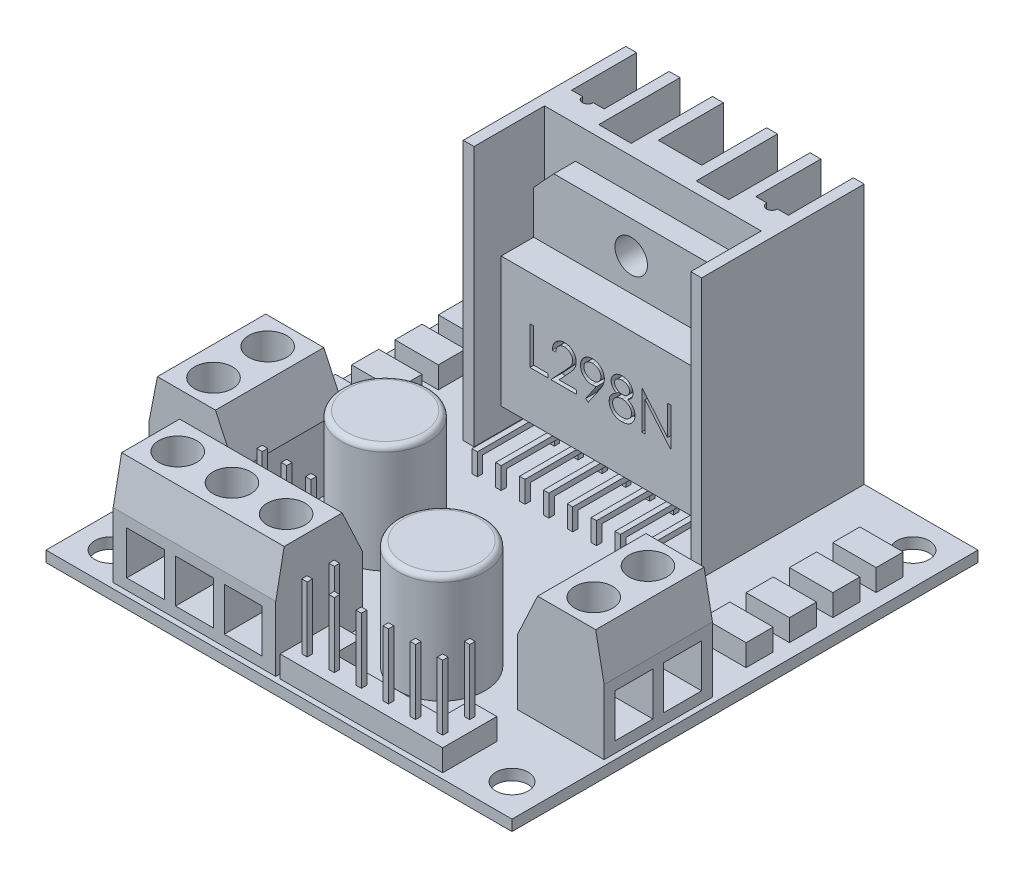
from build123d import *
from OCP.BRepFilletAPI import BRepFilletAPI_MakeChamfer

# Parameters (mm, degrees)
BASE_SKETCH_W             = 43
BASE_SKETCH_H             = 43
BASE_SKETCH_R             = 1.5
BASE_DEPTH                = 1
RADIATOR_DEPTH            = 24
TERMINAL_1_SKETCH_W       = 8
TERMINAL_1_SKETCH_H       = 10
TERMINAL_1_DEPTH          = 10
TERMINAL_2_SKETCH_W       = 15
TERMINAL_2_SKETCH_H       = 8
TERMINAL_2_DEPTH          = 10
CHAMFER_25_SIZE           = 4
CHAMFER_25_SIZE2          = 1.865230633
CHAMFER_10_SIZE           = 4
CHAMFER_10_SIZE2          = 0.777521237
DIODE_SKETCH_W            = 4
DIODE_SKETCH_H            = 2.5
DIODE_DEPTH               = 2
CAPACITOR_SKETCH_R        = 4
CAPACITOR_DEPTH           = 10
FILLET_2_R                = 0.5
RAIL_6_DEPTH              = 2
RAIL_3_SKETCH_W           = 6.6
RAIL_3_SKETCH_H           = 2.2
RAIL_3_DEPTH              = 2
JACK_6_SKETCH_W           = 0.25
JACK_6_SKETCH_H           = 0.25
JACK_6_SKETCH_H_2         = 0.5
JACK_6_SKETCH_W_2         = 0.5
JACK_6_DEPTH              = 6
JACK_3_SKETCH_W           = 0.5
JACK_3_SKETCH_H           = 0.5
JACK_3_DEPTH              = 6
L298_IC_DEPTH             = 5
L298_CUT_SKETCH_W         = 18
L298_CUT_SKETCH_H         = 6
L298_CUT_DEPTH            = 3
L298_LEG_1_SKETCH_W       = 0.5
L298_LEG_1_SKETCH_H       = 0.5
L298_LEG_1_DEPTH          = 1.5
L298_LEG_2_SKETCH_W       = 0.5
L298_LEG_2_SKETCH_H       = 0.5
L298_LEG_2_DEPTH          = 6
L298_LEG_3_SKETCH_W       = 0.5
L298_LEG_3_SKETCH_H       = 0.5
L298_LEG_3_DEPTH          = 2.5
BOSS_EXTRUDE1_REACH       = 67.376
SKETCH1_W                 = 0.5
SKETCH1_H                 = 0.5
L298_NAME_DEPTH           = 1
ROLE_SKETCH_R             = 1.5
ROLE_DEPTH                = 60.415906961
ROLE_TERMINAL_1A_SKETCH_W = 3.5
ROLE_TERMINAL_1A_SKETCH_H = 4
ROLE_TERMINAL_1A_DEPTH    = 4
ROLE_TERMINAL_1B_SKETCH_W = 3.5
ROLE_TERMINAL_1B_SKETCH_H = 4
ROLE_TERMINAL_1B_DEPTH    = 3.5
ROLE_TERMINAL_2_SKETCH_W  = 3.5
ROLE_TERMINAL_2_SKETCH_H  = 4
ROLE_TERMINAL_2_DEPTH     = 3.5
SKETCH4_R                 = 1.75
ROLE_TERMINAL_3_DEPTH     = 3.5


with BuildPart() as part:
    # base_sketch → base (new body)
    with BuildSketch(Plane(origin=(0, 0, 0), x_dir=(1, 0, 0), z_dir=(0, 1, 0))):
        with Locations((-21.5, -21.5)):
            Rectangle(BASE_SKETCH_W, BASE_SKETCH_H)
        with Locations(Location((-40, -3, 0), (0, 0, 270))):
            Circle(BASE_SKETCH_R, mode=Mode.SUBTRACT)
        with Locations(Location((-3, -3, 0), (0, 0, 270))):
            Circle(BASE_SKETCH_R, mode=Mode.SUBTRACT)
        with Locations(Location((-40, -40, 0), (0, 0, 270))):
            Circle(BASE_SKETCH_R, mode=Mode.SUBTRACT)
        with Locations(Location((-3, -40, 0), (0, 0, 270))):
            Circle(BASE_SKETCH_R, mode=Mode.SUBTRACT)
    extrude(amount=BASE_DEPTH)

    # radiator_sketch → radiator (add)
    with BuildSketch(Plane(origin=(0, 1, 0), x_dir=(-1, 0, 0), z_dir=(0, 1, 0))):
        with BuildLine():
            Line((10.5, 0), (11.5, 0))
            Line((11.5, 0), (11.5, 6))
            Line((11.5, 6), (12.5, 6))
            ThreePointArc((12.5, 6), (13, 6.5), (13.5, 6))
            Line((13.5, 6), (14.5, 6))
            Line((14.5, 6), (14.5, 0))
            Line((14.5, 0), (15.5, 0))
            Line((15.5, 0), (15.5, 7.5))
            Line((15.5, 7.5), (18.5, 7.5))
            Line((18.5, 7.5), (18.5, 0))
            Line((18.5, 0), (19.5, 0))
            Line((19.5, 0), (19.5, 6))
            Line((19.5, 6), (23.5, 6))
            Line((23.5, 6), (23.5, 0))
            Line((23.5, 0), (24.5, 0))
            Line((24.5, 0), (24.5, 7.5))
            Line((24.5, 7.5), (27.5, 7.5))
            Line((27.5, 7.5), (27.5, 0))
            Line((27.5, 0), (28.5, 0))
            Line((28.5, 0), (28.5, 6))
            Line((28.5, 6), (29.5, 6))
            ThreePointArc((29.5, 6), (30, 6.5), (30.5, 6))
            Line((30.5, 6), (31.5, 6))
            Line((31.5, 6), (31.5, 0))
            Line((31.5, 0), (32.5, 0))
            Line((32.5, 0), (32.5, 15))
            Line((32.5, 15), (31.5, 15))
            Line((31.5, 15), (31.5, 8.5))
            Line((31.5, 8.5), (11.5, 8.5))
            Line((11.5, 8.5), (11.5, 15))
            Line((11.5, 15), (10.5, 15))
            Line((10.5, 15), (10.5, 0))
        make_face()
    extrude(amount=RADIATOR_DEPTH)

    # terminal_1_sketch → terminal_1 (add)
    with BuildSketch(Plane(origin=(0, 1, 0), x_dir=(-1, 0, 0), z_dir=(0, 1, 0))):
        with Locations((4.5, 29)):
            Rectangle(TERMINAL_1_SKETCH_W, TERMINAL_1_SKETCH_H)
        with Locations((38.5, 29)):
            Rectangle(TERMINAL_1_SKETCH_W, TERMINAL_1_SKETCH_H)
    extrude(amount=TERMINAL_1_DEPTH)

    # terminal_2_sketch → terminal_2 (add)
    with BuildSketch(Plane(origin=(0, 1, 0), x_dir=(-1, 0, 0), z_dir=(0, 1, 0))):
        with Locations((29.8, 38.5)):
            Rectangle(TERMINAL_2_SKETCH_W, TERMINAL_2_SKETCH_H)
    extrude(amount=TERMINAL_2_DEPTH)

    # chamfer_25: one chamfer whose edges measure the first distance from different faces: ONE call of the kernel's chamfer builder (chamfer() names one face for all edges)
    chamfer_25_edges_1 = [part.edges().sort_by_distance(p)[0] for p in [
        (-34.5, 11, 29),
    ]]
    chamfer_25_side_1 = [part.faces().sort_by_distance(p)[0] for p in [
        (-34.5, 6, 29),
    ]]
    chamfer_25_edges_2 = [part.edges().sort_by_distance(p)[0] for p in [
        (-8.5, 11, 29),
    ]]
    chamfer_25_side_2 = [part.faces().sort_by_distance(p)[0] for p in [
        (-8.5, 6, 29),
    ]]
    chamfer_25_edges_3 = [part.edges().sort_by_distance(p)[0] for p in [
        (-29.8, 11, 34.5),
    ]]
    chamfer_25_side_3 = [part.faces().sort_by_distance(p)[0] for p in [
        (-29.8, 6, 34.5),
    ]]
    chamfer_25 = BRepFilletAPI_MakeChamfer(part.part.solid().wrapped)
    for e in chamfer_25_edges_1:
        chamfer_25.Add(CHAMFER_25_SIZE, CHAMFER_25_SIZE2, e.wrapped, chamfer_25_side_1[0].wrapped)  # the first distance lies on this face
    for e in chamfer_25_edges_2:
        chamfer_25.Add(CHAMFER_25_SIZE, CHAMFER_25_SIZE2, e.wrapped, chamfer_25_side_2[0].wrapped)  # the first distance lies on this face
    for e in chamfer_25_edges_3:
        chamfer_25.Add(CHAMFER_25_SIZE, CHAMFER_25_SIZE2, e.wrapped, chamfer_25_side_3[0].wrapped)  # the first distance lies on this face
    add(Compound.cast(chamfer_25.Shape()), mode=Mode.REPLACE)

    # chamfer_10: one chamfer whose edges measure the first distance from different faces: ONE call of the kernel's chamfer builder (chamfer() names one face for all edges)
    chamfer_10_edges_1 = [part.edges().sort_by_distance(p)[0] for p in [
        (-42.5, 11, 29),
    ]]
    chamfer_10_side_1 = [part.faces().sort_by_distance(p)[0] for p in [
        (-42.5, 6, 29),
    ]]
    chamfer_10_edges_2 = [part.edges().sort_by_distance(p)[0] for p in [
        (-0.5, 11, 29),
    ]]
    chamfer_10_side_2 = [part.faces().sort_by_distance(p)[0] for p in [
        (-0.5, 6, 29),
    ]]
    chamfer_10_edges_3 = [part.edges().sort_by_distance(p)[0] for p in [
        (-29.8, 11, 42.5),
    ]]
    chamfer_10_side_3 = [part.faces().sort_by_distance(p)[0] for p in [
        (-29.8, 6, 42.5),
    ]]
    chamfer_10 = BRepFilletAPI_MakeChamfer(part.part.solid().wrapped)
    for e in chamfer_10_edges_1:
        chamfer_10.Add(CHAMFER_10_SIZE, CHAMFER_10_SIZE2, e.wrapped, chamfer_10_side_1[0].wrapped)  # the first distance lies on this face
    for e in chamfer_10_edges_2:
        chamfer_10.Add(CHAMFER_10_SIZE, CHAMFER_10_SIZE2, e.wrapped, chamfer_10_side_2[0].wrapped)  # the first distance lies on this face
    for e in chamfer_10_edges_3:
        chamfer_10.Add(CHAMFER_10_SIZE, CHAMFER_10_SIZE2, e.wrapped, chamfer_10_side_3[0].wrapped)  # the first distance lies on this face
    add(Compound.cast(chamfer_10.Shape()), mode=Mode.REPLACE)

    # diode_sketch → diode (add)
    with BuildSketch(Plane(origin=(0, 1, 0), x_dir=(-1, 0, 0), z_dir=(0, 1, 0))):
        with Locations((3.3, 10.85)):
            Rectangle(DIODE_SKETCH_W, DIODE_SKETCH_H)
        with Locations((3.3, 6.85)):
            Rectangle(DIODE_SKETCH_W, DIODE_SKETCH_H)
        with Locations((3.3, 14.85)):
            Rectangle(DIODE_SKETCH_W, DIODE_SKETCH_H)
        with Locations((3.3, 18.85)):
            Rectangle(DIODE_SKETCH_W, DIODE_SKETCH_H)
        with Locations((39.7, 18.85)):
            Rectangle(DIODE_SKETCH_W, DIODE_SKETCH_H)
        with Locations((39.7, 14.85)):
            Rectangle(DIODE_SKETCH_W, DIODE_SKETCH_H)
        with Locations((39.7, 10.85)):
            Rectangle(DIODE_SKETCH_W, DIODE_SKETCH_H)
        with Locations((39.7, 6.85)):
            Rectangle(DIODE_SKETCH_W, DIODE_SKETCH_H)
    extrude(amount=DIODE_DEPTH)

    # capacitor_sketch → capacitor (add)
    with BuildSketch(Plane(origin=(0, 1, 0), x_dir=(-1, 0, 0), z_dir=(0, 1, 0))):
        with Locations(Location((28.5, 26.2, 0), (0, 0, 90))):
            Circle(CAPACITOR_SKETCH_R)
        with Locations(Location((15.5, 34, 0), (0, 0, 90))):
            Circle(CAPACITOR_SKETCH_R)
    extrude(amount=CAPACITOR_DEPTH)

    # fillet 2
    fillet_2_edges = [part.edges().sort_by_distance(p)[0] for p in [
        (-28.5, 11, 22.2),
        (-15.5, 11, 30),
    ]]
    fillet(fillet_2_edges, radius=FILLET_2_R)

    # rail_6_sketch → rail_6 (add)
    with BuildSketch(Plane(origin=(0, 1, 0), x_dir=(-1, 0, 0), z_dir=(0, 1, 0))):
        Polygon((21.9, 42.5), (6.9, 42.5), (6.9, 37.5), (9.4, 37.5), (9.4, 40), (19.4, 40), (19.4, 37.5), (21.9, 37.5), align=None)
    extrude(amount=RAIL_6_DEPTH)

    # rail_3_sketch → rail_3 (add)
    with BuildSketch(Plane(origin=(0, 1, 0), x_dir=(-1, 0, 0), z_dir=(0, 1, 0))):
        with Locations((30.9, 32.9)):
            Rectangle(RAIL_3_SKETCH_W, RAIL_3_SKETCH_H)
    extrude(amount=RAIL_3_DEPTH)

    # jack_6_sketch → jack_6 (add)
    with BuildSketch(Plane(origin=(0, 3, 0), x_dir=(-1, 0, 0), z_dir=(0, 1, 0))):
        with Locations((20.525, 41.375)):
            Rectangle(JACK_6_SKETCH_W, JACK_6_SKETCH_H)
        with Locations((20.525, 41.125)):
            Rectangle(JACK_6_SKETCH_W, JACK_6_SKETCH_H)
        with Locations((20.775, 41.375)):
            Rectangle(JACK_6_SKETCH_W, JACK_6_SKETCH_H)
        with Locations((20.775, 41.125)):
            Rectangle(JACK_6_SKETCH_W, JACK_6_SKETCH_H)
        with Locations((20.525, 38.75)):
            Rectangle(JACK_6_SKETCH_W, JACK_6_SKETCH_H_2)
        with Locations((20.775, 38.75)):
            Rectangle(JACK_6_SKETCH_W, JACK_6_SKETCH_H_2)
        with Locations((18.15, 41.125)):
            Rectangle(JACK_6_SKETCH_W_2, JACK_6_SKETCH_H)
        with Locations((18.15, 41.375)):
            Rectangle(JACK_6_SKETCH_W_2, JACK_6_SKETCH_H)
        with Locations((15.65, 41.125)):
            Rectangle(JACK_6_SKETCH_W_2, JACK_6_SKETCH_H)
        with Locations((15.65, 41.375)):
            Rectangle(JACK_6_SKETCH_W_2, JACK_6_SKETCH_H)
        with Locations((13.15, 41.375)):
            Rectangle(JACK_6_SKETCH_W_2, JACK_6_SKETCH_H)
        with Locations((13.15, 41.125)):
            Rectangle(JACK_6_SKETCH_W_2, JACK_6_SKETCH_H)
        with Locations((10.65, 41.375)):
            Rectangle(JACK_6_SKETCH_W_2, JACK_6_SKETCH_H)
        with Locations((10.65, 41.125)):
            Rectangle(JACK_6_SKETCH_W_2, JACK_6_SKETCH_H)
        with Locations((8.025, 41.375)):
            Rectangle(JACK_6_SKETCH_W, JACK_6_SKETCH_H)
        with Locations((8.025, 41.125)):
            Rectangle(JACK_6_SKETCH_W, JACK_6_SKETCH_H)
        with Locations((8.275, 41.125)):
            Rectangle(JACK_6_SKETCH_W, JACK_6_SKETCH_H)
        with Locations((8.275, 41.375)):
            Rectangle(JACK_6_SKETCH_W, JACK_6_SKETCH_H)
        with Locations((8.025, 38.75)):
            Rectangle(JACK_6_SKETCH_W, JACK_6_SKETCH_H_2)
        with Locations((8.275, 38.75)):
            Rectangle(JACK_6_SKETCH_W, JACK_6_SKETCH_H_2)
    extrude(amount=JACK_6_DEPTH)

    # jack_3_sketch → jack_3 (add)
    with BuildSketch(Plane(origin=(0, 3, 0), x_dir=(1, 0, 0), z_dir=(0, 1, 0))):
        with Locations((-30.9, -32.9)):
            Rectangle(JACK_3_SKETCH_W, JACK_3_SKETCH_H)
        with Locations((-33.15, -32.9)):
            Rectangle(JACK_3_SKETCH_W, JACK_3_SKETCH_H)
        with Locations((-28.65, -32.9)):
            Rectangle(JACK_3_SKETCH_W, JACK_3_SKETCH_H)
    extrude(amount=JACK_3_DEPTH)

    # L298_sketch → L298_IC (add)
    with BuildSketch(Plane.XY.offset(8.5)):
        Polygon((-30.5, 19.987466442), (-30.5, 4), (-12.5, 4), (-12.5, 19.987466442), (-14.362533558, 22), (-28.637466442, 22), align=None)
    extrude(amount=L298_IC_DEPTH)

    # L298_cut_sketch → L298_cut (cut)
    with BuildSketch(Plane.XY.offset(13.5)):
        with Locations((-21.5, 19)):
            Rectangle(L298_CUT_SKETCH_W, L298_CUT_SKETCH_H)
    extrude(amount=-L298_CUT_DEPTH, mode=Mode.SUBTRACT)

    # L298_leg_1_sketch → L298_leg_1 (add)
    with BuildSketch(Plane.XZ.offset(-4)):
        with Locations((-28.1, 11)):
            Rectangle(L298_LEG_1_SKETCH_W, L298_LEG_1_SKETCH_H)
        with Locations((-29.2, 11)):
            Rectangle(L298_LEG_1_SKETCH_W, L298_LEG_1_SKETCH_H)
        with Locations((-27, 11)):
            Rectangle(L298_LEG_1_SKETCH_W, L298_LEG_1_SKETCH_H)
        with Locations((-25.9, 11)):
            Rectangle(L298_LEG_1_SKETCH_W, L298_LEG_1_SKETCH_H)
        with Locations((-24.8, 11)):
            Rectangle(L298_LEG_1_SKETCH_W, L298_LEG_1_SKETCH_H)
        with Locations((-23.7, 11)):
            Rectangle(L298_LEG_1_SKETCH_W, L298_LEG_1_SKETCH_H)
        with Locations((-22.6, 11)):
            Rectangle(L298_LEG_1_SKETCH_W, L298_LEG_1_SKETCH_H)
        with Locations((-21.5, 11)):
            Rectangle(L298_LEG_1_SKETCH_W, L298_LEG_1_SKETCH_H)
        with Locations((-20.4, 11)):
            Rectangle(L298_LEG_1_SKETCH_W, L298_LEG_1_SKETCH_H)
        with Locations((-19.3, 11)):
            Rectangle(L298_LEG_1_SKETCH_W, L298_LEG_1_SKETCH_H)
        with Locations((-18.2, 11)):
            Rectangle(L298_LEG_1_SKETCH_W, L298_LEG_1_SKETCH_H)
        with Locations((-17.1, 11)):
            Rectangle(L298_LEG_1_SKETCH_W, L298_LEG_1_SKETCH_H)
        with Locations((-16, 11)):
            Rectangle(L298_LEG_1_SKETCH_W, L298_LEG_1_SKETCH_H)
        with Locations((-14.9, 11)):
            Rectangle(L298_LEG_1_SKETCH_W, L298_LEG_1_SKETCH_H)
        with Locations((-13.8, 11)):
            Rectangle(L298_LEG_1_SKETCH_W, L298_LEG_1_SKETCH_H)
    extrude(amount=L298_LEG_1_DEPTH)

    # L298_leg_2_sketch → L298_leg_2 (add)
    with BuildSketch(Plane.XY.offset(11.25)):
        with Locations((-13.8, 2.75)):
            Rectangle(L298_LEG_2_SKETCH_W, L298_LEG_2_SKETCH_H)
        with Locations((-16, 2.75)):
            Rectangle(L298_LEG_2_SKETCH_W, L298_LEG_2_SKETCH_H)
        with Locations((-18.2, 2.75)):
            Rectangle(L298_LEG_2_SKETCH_W, L298_LEG_2_SKETCH_H)
        with Locations((-20.4, 2.75)):
            Rectangle(L298_LEG_2_SKETCH_W, L298_LEG_2_SKETCH_H)
        with Locations((-22.6, 2.75)):
            Rectangle(L298_LEG_2_SKETCH_W, L298_LEG_2_SKETCH_H)
        with Locations((-24.8, 2.75)):
            Rectangle(L298_LEG_2_SKETCH_W, L298_LEG_2_SKETCH_H)
        with Locations((-27, 2.75)):
            Rectangle(L298_LEG_2_SKETCH_W, L298_LEG_2_SKETCH_H)
        with Locations((-29.2, 2.75)):
            Rectangle(L298_LEG_2_SKETCH_W, L298_LEG_2_SKETCH_H)
    extrude(amount=L298_LEG_2_DEPTH)

    # L298_leg_3_sketch → L298_leg_3 (add)
    with BuildSketch(Plane.XZ):
        with Locations((-29.2, 17)):
            Rectangle(L298_LEG_3_SKETCH_W, L298_LEG_3_SKETCH_H)
        with Locations((-27, 17)):
            Rectangle(L298_LEG_3_SKETCH_W, L298_LEG_3_SKETCH_H)
        with Locations((-24.8, 17)):
            Rectangle(L298_LEG_3_SKETCH_W, L298_LEG_3_SKETCH_H)
        with Locations((-22.6, 17)):
            Rectangle(L298_LEG_3_SKETCH_W, L298_LEG_3_SKETCH_H)
        with Locations((-20.4, 17)):
            Rectangle(L298_LEG_3_SKETCH_W, L298_LEG_3_SKETCH_H)
        with Locations((-18.2, 17)):
            Rectangle(L298_LEG_3_SKETCH_W, L298_LEG_3_SKETCH_H)
        with Locations((-16, 17)):
            Rectangle(L298_LEG_3_SKETCH_W, L298_LEG_3_SKETCH_H)
        with Locations((-13.8, 17)):
            Rectangle(L298_LEG_3_SKETCH_W, L298_LEG_3_SKETCH_H)
    extrude(amount=-L298_LEG_3_DEPTH)

    # Sketch1 → Boss-Extrude1 (add, up to next)
    with BuildSketch(Plane(origin=(0, 1, 0), x_dir=(1, 0, 0), z_dir=(0, 1, 0)), mode=Mode.PRIVATE) as boss_extrude1_sk1:
        with Locations((-14.9, -11)):
            Rectangle(SKETCH1_W, SKETCH1_H)
    boss_extrude1_tool1 = extrude(boss_extrude1_sk1.sketch, amount=BOSS_EXTRUDE1_REACH, mode=Mode.PRIVATE) - part.part
    # Sketch1 → Boss-Extrude1 (add, up to next)
    with BuildSketch(Plane(origin=(0, 1, 0), x_dir=(1, 0, 0), z_dir=(0, 1, 0)), mode=Mode.PRIVATE) as boss_extrude1_sk2:
        with Locations((-17.1, -11)):
            Rectangle(SKETCH1_W, SKETCH1_H)
    boss_extrude1_tool2 = extrude(boss_extrude1_sk2.sketch, amount=BOSS_EXTRUDE1_REACH, mode=Mode.PRIVATE) - part.part
    # Sketch1 → Boss-Extrude1 (add, up to next)
    with BuildSketch(Plane(origin=(0, 1, 0), x_dir=(1, 0, 0), z_dir=(0, 1, 0)), mode=Mode.PRIVATE) as boss_extrude1_sk3:
        with Locations((-19.3, -11)):
            Rectangle(SKETCH1_W, SKETCH1_H)
    boss_extrude1_tool3 = extrude(boss_extrude1_sk3.sketch, amount=BOSS_EXTRUDE1_REACH, mode=Mode.PRIVATE) - part.part
    # Sketch1 → Boss-Extrude1 (add, up to next)
    with BuildSketch(Plane(origin=(0, 1, 0), x_dir=(1, 0, 0), z_dir=(0, 1, 0)), mode=Mode.PRIVATE) as boss_extrude1_sk4:
        with Locations((-21.5, -11)):
            Rectangle(SKETCH1_W, SKETCH1_H)
    boss_extrude1_tool4 = extrude(boss_extrude1_sk4.sketch, amount=BOSS_EXTRUDE1_REACH, mode=Mode.PRIVATE) - part.part
    # Sketch1 → Boss-Extrude1 (add, up to next)
    with BuildSketch(Plane(origin=(0, 1, 0), x_dir=(1, 0, 0), z_dir=(0, 1, 0)), mode=Mode.PRIVATE) as boss_extrude1_sk5:
        with Locations((-23.7, -11)):
            Rectangle(SKETCH1_W, SKETCH1_H)
    boss_extrude1_tool5 = extrude(boss_extrude1_sk5.sketch, amount=BOSS_EXTRUDE1_REACH, mode=Mode.PRIVATE) - part.part
    # Sketch1 → Boss-Extrude1 (add, up to next)
    with BuildSketch(Plane(origin=(0, 1, 0), x_dir=(1, 0, 0), z_dir=(0, 1, 0)), mode=Mode.PRIVATE) as boss_extrude1_sk6:
        with Locations((-25.9, -11)):
            Rectangle(SKETCH1_W, SKETCH1_H)
    boss_extrude1_tool6 = extrude(boss_extrude1_sk6.sketch, amount=BOSS_EXTRUDE1_REACH, mode=Mode.PRIVATE) - part.part
    # Sketch1 → Boss-Extrude1 (add, up to next)
    with BuildSketch(Plane(origin=(0, 1, 0), x_dir=(1, 0, 0), z_dir=(0, 1, 0)), mode=Mode.PRIVATE) as boss_extrude1_sk7:
        with Locations((-28.1, -11)):
            Rectangle(SKETCH1_W, SKETCH1_H)
    boss_extrude1_tool7 = extrude(boss_extrude1_sk7.sketch, amount=BOSS_EXTRUDE1_REACH, mode=Mode.PRIVATE) - part.part
    add(boss_extrude1_tool1.solids().sort_by_distance((-14.9, 1, 11))[0])
    add(boss_extrude1_tool2.solids().sort_by_distance((-17.1, 1, 11))[0])
    add(boss_extrude1_tool3.solids().sort_by_distance((-19.3, 1, 11))[0])
    add(boss_extrude1_tool4.solids().sort_by_distance((-21.5, 1, 11))[0])
    add(boss_extrude1_tool5.solids().sort_by_distance((-23.7, 1, 11))[0])
    add(boss_extrude1_tool6.solids().sort_by_distance((-25.9, 1, 11))[0])
    add(boss_extrude1_tool7.solids().sort_by_distance((-28.1, 1, 11))[0])

    # L298_name_sketch → L298_name (cut)
    # profile 1 of 5: a face of its own
    with BuildSketch(Plane.XY.offset(13.5)):
        Polygon((-27.846931762, 11.915865738), (-27.532829198, 11.915865738), (-27.532829198, 8.774840097), (-26.186675351, 8.774840097), (-26.186675351, 8.415865738), (-27.846931762, 8.415865738), align=None)
    # profile 2 of 5: a face of its own
    with BuildSketch(Plane.XY.offset(13.5)):
        with BuildLine():
            Line((-25.468726633, 10.838942661), (-25.782829198, 10.838942661))
            add(Edge.make_bspline(
                [(-25.782829198, 10.838942661), (-25.780782045, 10.880613549), (-25.77676149, 10.962454063), (-25.757933201, 11.08177797), (-25.730992324, 11.195832768), (-25.69290087, 11.303702682), (-25.645594592, 11.40634149), (-25.588864565, 11.503341505), (-25.521670714, 11.594332694), (-25.44546398, 11.678471537), (-25.362695341, 11.755659108), (-25.273389402, 11.822314351), (-25.179544374, 11.878632022), (-25.081444976, 11.925713264), (-24.977984412, 11.96105311), (-24.870101554, 11.98727475), (-24.757322418, 12.003051095), (-24.680482396, 12.004746881), (-24.641402915, 12.005609328)],
                knots=[0, 0, 0, 0, 1.10065271, 2.161652631, 3.183658789, 4.190468796, 5.17591951, 6.163126047, 7.15150782, 8.156236427, 9.156009102, 10.134482811, 11.092018607, 12.041330605, 13.001268258, 13.972401359, 14.968799086, 16, 16, 16, 16], degree=3))
            add(Edge.make_bspline(
                [(-24.641402915, 12.005609328), (-24.603024841, 12.004710871), (-24.527613297, 12.002945436), (-24.417551282, 11.987784407), (-24.312773988, 11.964038815), (-24.213486221, 11.930723399), (-24.120480157, 11.885938972), (-24.033057112, 11.832141433), (-23.950176301, 11.769921602), (-23.875569518, 11.696667788), (-23.807061439, 11.618465404), (-23.747959183, 11.5349775), (-23.69734602, 11.448748214), (-23.65515834, 11.359120013), (-23.624102201, 11.265248985), (-23.600523993, 11.168501782), (-23.587196579, 11.067876971), (-23.585151156, 10.999770415), (-23.584111249, 10.965144584)],
                knots=[0, 0, 0, 0, 1.111607364, 2.184268762, 3.212621178, 4.221274766, 5.211760367, 6.196651075, 7.1921475, 8.207485113, 9.220403448, 10.201281604, 11.166441695, 12.114753415, 13.065576456, 14.026450734, 14.996634279, 16, 16, 16, 16], degree=3))
            add(Edge.make_bspline(
                [(-23.584111249, 10.965144584), (-23.585804512, 10.916396749), (-23.589161323, 10.819756536), (-23.6178757, 10.677741673), (-23.662722211, 10.540148254), (-23.716719568, 10.429410952), (-23.771192012, 10.340177458), (-23.820279519, 10.266708753), (-23.87774433, 10.187603285), (-23.944422828, 10.103125947), (-24.0189357, 10.012615042), (-24.101957864, 9.916125247), (-24.194081346, 9.814653477), (-24.258739846, 9.745347876), (-24.292244262, 9.709435449)],
                knots=[0, 0, 0, 0, 1.184426356, 2.348067706, 3.509069118, 4.696110526, 5.333549288, 6.050745305, 6.844228056, 7.710549037, 8.667450064, 9.695053472, 10.805634456, 12, 12, 12, 12], degree=3))
            Line((-24.292244262, 9.709435449), (-25.167945383, 8.774840097))
            Line((-25.167945383, 8.774840097), (-23.539239454, 8.774840097))
            Line((-23.539239454, 8.774840097), (-23.539239454, 8.415865738))
            Line((-23.539239454, 8.415865738), (-25.917444582, 8.415865738))
            Line((-25.917444582, 8.415865738), (-24.560072787, 9.864383366))
            add(Edge.make_bspline(
                [(-24.560072787, 9.864383366), (-24.5270249, 9.898881673), (-24.463546673, 9.965145859), (-24.373764097, 10.061888819), (-24.293125108, 10.15163836), (-24.221107715, 10.234224909), (-24.15927421, 10.310856476), (-24.104401978, 10.37905118), (-24.060436387, 10.44180563), (-24.012720991, 10.514546244), (-23.96650701, 10.603358561), (-23.926794654, 10.711892251), (-23.902579806, 10.823619503), (-23.89967497, 10.89912154), (-23.898213813, 10.937099712)],
                knots=[0, 0, 0, 0, 1.329631726, 2.553950428, 3.673215718, 4.687767853, 5.603093632, 6.413772471, 7.123043292, 7.734684054, 8.834405432, 9.900288307, 10.943827018, 12, 12, 12, 12], degree=3))
            add(Edge.make_bspline(
                [(-23.898213813, 10.937099712), (-23.898849555, 10.960981111), (-23.900102481, 11.008046761), (-23.911160179, 11.07705252), (-23.927870685, 11.143617334), (-23.951815943, 11.207945953), (-23.983422683, 11.269391605), (-24.021896063, 11.328029085), (-24.066286126, 11.38471805), (-24.117637396, 11.437871349), (-24.174048915, 11.486552554), (-24.233643165, 11.529676639), (-24.296693269, 11.56571575), (-24.362933391, 11.595259247), (-24.432178861, 11.618434629), (-24.504563606, 11.634493208), (-24.579887622, 11.644575692), (-24.631321118, 11.645939864), (-24.657528717, 11.646634969)],
                knots=[0, 0, 0, 0, 0.991446411, 1.95395049, 2.89581595, 3.838931463, 4.798493298, 5.75982156, 6.748411868, 7.785213223, 8.824556874, 9.840280684, 10.836137867, 11.835679398, 12.848801643, 13.863922112, 14.911575587, 16, 16, 16, 16], degree=3))
            add(Edge.make_bspline(
                [(-24.657528717, 11.646634969), (-24.68489955, 11.645919936), (-24.738651346, 11.644515731), (-24.817570379, 11.634693067), (-24.892856156, 11.617747227), (-24.964698059, 11.594570552), (-25.033217645, 11.565112004), (-25.098081689, 11.528420259), (-25.159144578, 11.484636766), (-25.216521102, 11.434996209), (-25.269385081, 11.379728608), (-25.315831957, 11.318118645), (-25.356415971, 11.25129123), (-25.391825204, 11.179426679), (-25.420580894, 11.101872899), (-25.442554045, 11.018905194), (-25.459940891, 10.930883813), (-25.465749412, 10.870098728), (-25.468726633, 10.838942661)],
                knots=[0, 0, 0, 0, 1.031018746, 2.02475058, 2.990194455, 3.934040569, 4.864654155, 5.795059489, 6.735614925, 7.690564532, 8.649604399, 9.611025574, 10.590972636, 11.591080095, 12.624614302, 13.701020113, 14.821632451, 16, 16, 16, 16], degree=3))
        make_face()
    # profile 3 of 5: a face of its own
    with BuildSketch(Plane.XY.offset(13.5)):
        with BuildLine():
            Line((-22.462316377, 8.326122148), (-22.71331798, 8.500701475))
            Line((-22.71331798, 8.500701475), (-21.740160928, 9.923277597))
            add(Edge.make_bspline(
                [(-21.740160928, 9.923277597), (-21.802251664, 9.915684534), (-21.924511784, 9.900733369), (-22.047648886, 9.897986714), (-22.108249871, 9.896634969)],
                knots=[0, 0, 0, 0, 1.015715272, 2, 2, 2, 2], degree=3))
            add(Edge.make_bspline(
                [(-22.108249871, 9.896634969), (-22.144991918, 9.897576045), (-22.217113345, 9.899423296), (-22.323144998, 9.914065104), (-22.425030558, 9.936615232), (-22.522499914, 9.970263987), (-22.615919419, 10.012082196), (-22.705085133, 10.06393921), (-22.789877023, 10.124945501), (-22.869384433, 10.194778493), (-22.941696172, 10.271456545), (-23.00611947, 10.352612188), (-23.059660602, 10.439188159), (-23.104137187, 10.529418378), (-23.137867641, 10.624599729), (-23.162430178, 10.723649129), (-23.177552532, 10.827260771), (-23.179351628, 10.897785902), (-23.180265095, 10.933594103)],
                knots=[0, 0, 0, 0, 1.060718605, 2.082097864, 3.085795603, 4.069760067, 5.054557537, 6.03741023, 7.043284206, 8.066802108, 9.088538119, 10.083643548, 11.053783639, 12.022749082, 12.983451788, 13.964007469, 14.966251758, 16, 16, 16, 16], degree=3))
            add(Edge.make_bspline(
                [(-23.180265095, 10.933594103), (-23.17853066, 10.982562756), (-23.175126317, 11.078678288), (-23.147727799, 11.219112057), (-23.10266746, 11.3518986), (-23.039839083, 11.476688794), (-22.960704362, 11.591687533), (-22.865595772, 11.695296142), (-22.755091807, 11.786040996), (-22.631709788, 11.864045074), (-22.498356768, 11.926780071), (-22.358688109, 11.973019371), (-22.213773989, 12.000218119), (-22.115606319, 12.00380398), (-22.066182563, 12.005609328)],
                knots=[0, 0, 0, 0, 1.022988612, 2.007919123, 2.978103895, 3.94594894, 4.918897164, 5.887013414, 6.875921846, 7.89917871, 8.930658928, 9.948724884, 10.967259574, 12, 12, 12, 12], degree=3))
            add(Edge.make_bspline(
                [(-22.066182563, 12.005609328), (-22.017694143, 12.003779165), (-21.921885596, 12.000162935), (-21.78099659, 11.973678966), (-21.646055573, 11.929042293), (-21.517810586, 11.867357729), (-21.399071174, 11.790036822), (-21.292295363, 11.697902298), (-21.199919824, 11.590896771), (-21.122095943, 11.471608281), (-21.059625903, 11.343441299), (-21.01455362, 11.209657377), (-20.986807981, 11.071218656), (-20.983311654, 10.977424181), (-20.981547146, 10.930088494)],
                knots=[0, 0, 0, 0, 1.026385292, 2.028040595, 3.023318987, 4.028184125, 5.03290303, 6.015178782, 7.004435299, 8.016004309, 9.023023918, 10.015172535, 10.998308025, 12, 12, 12, 12], degree=3))
            add(Edge.make_bspline(
                [(-20.981547146, 10.930088494), (-20.982725555, 10.893344727), (-20.985115663, 10.818819186), (-21.00185197, 10.705588844), (-21.030272155, 10.590137614), (-21.062523854, 10.492416018), (-21.093656022, 10.411707569), (-21.122957153, 10.347955989), (-21.155469307, 10.280854725), (-21.193388072, 10.211107387), (-21.234150369, 10.137824852), (-21.280209646, 10.061742137), (-21.330515217, 9.982757144), (-21.366344937, 9.929510056), (-21.384692178, 9.902243943)],
                knots=[0, 0, 0, 0, 1.179839688, 2.393009684, 3.667231171, 4.993948276, 5.694988576, 6.444077775, 7.246288328, 8.089075292, 8.993003841, 9.939041771, 10.944649915, 12, 12, 12, 12], degree=3))
            Line((-21.384692178, 9.902243943), (-22.462316377, 8.326122148))
        make_face()
        with BuildLine():
            add(Edge.make_bspline(
                [(-22.050056762, 10.255609328), (-22.022222748, 10.256369711), (-21.968039384, 10.25784992), (-21.888662085, 10.266859162), (-21.813737882, 10.282833148), (-21.743066633, 10.30575286), (-21.675939731, 10.333409529), (-21.613423403, 10.368621515), (-21.555465327, 10.41063815), (-21.5016774, 10.457848166), (-21.453913401, 10.510298749), (-21.41137037, 10.565195856), (-21.375209802, 10.622780466), (-21.346646525, 10.683773728), (-21.32316195, 10.746690937), (-21.306943938, 10.812545292), (-21.297959605, 10.880993693), (-21.29642803, 10.927492351), (-21.29564971, 10.951122148)],
                knots=[0, 0, 0, 0, 1.163407946, 2.26475976, 3.333800367, 4.359385343, 5.366239384, 6.363380779, 7.350133999, 8.353570782, 9.349036268, 10.310270964, 11.253520213, 12.184142, 13.120487599, 14.056272588, 15.012232024, 16, 16, 16, 16], degree=3))
            add(Edge.make_bspline(
                [(-21.29564971, 10.951122148), (-21.29631938, 10.974761813), (-21.297639045, 11.021346673), (-21.308226344, 11.089896413), (-21.326851568, 11.155589674), (-21.351842052, 11.218786104), (-21.38476229, 11.278966476), (-21.424265776, 11.336886348), (-21.471198226, 11.392178475), (-21.525200792, 11.443542459), (-21.583435345, 11.490890358), (-21.645495845, 11.532676434), (-21.710870761, 11.567697631), (-21.779161251, 11.5965966), (-21.8505096, 11.619148376), (-21.924873588, 11.635365741), (-22.002628994, 11.644337495), (-22.05541028, 11.64585939), (-22.082308364, 11.646634969)],
                knots=[0, 0, 0, 0, 0.972161553, 1.915763587, 2.844109794, 3.775983486, 4.705125789, 5.659731448, 6.655561913, 7.682237399, 8.721216875, 9.739758359, 10.754845918, 11.767244016, 12.7857855, 13.828538656, 14.893392813, 16, 16, 16, 16], degree=3))
            add(Edge.make_bspline(
                [(-22.082308364, 11.646634969), (-22.108972518, 11.645858137), (-22.161287367, 11.644334), (-22.238351526, 11.635382794), (-22.312212694, 11.61903931), (-22.383354314, 11.596607046), (-22.451642775, 11.567695475), (-22.517014608, 11.532674599), (-22.579089624, 11.490899977), (-22.637268345, 11.443505204), (-22.691366267, 11.392417558), (-22.737491796, 11.336644129), (-22.777085688, 11.278996605), (-22.809960691, 11.218778097), (-22.834963208, 11.155591811), (-22.85358521, 11.089895834), (-22.864173375, 11.021346824), (-22.865492922, 10.974761864), (-22.866162531, 10.951122148)],
                knots=[0, 0, 0, 0, 1.099389452, 2.15699305, 3.192601482, 4.213358962, 5.227959689, 6.245255729, 7.266013209, 8.307253147, 9.336162325, 10.327954924, 11.284637477, 12.215801273, 13.149702402, 14.080068371, 15.025723358, 16, 16, 16, 16], degree=3))
            add(Edge.make_bspline(
                [(-22.866162531, 10.951122148), (-22.865556605, 10.927473949), (-22.864361608, 10.880835373), (-22.852833818, 10.81230898), (-22.833555538, 10.746620786), (-22.807736147, 10.683132079), (-22.773734557, 10.622460221), (-22.732010709, 10.564892859), (-22.683105163, 10.509777409), (-22.627671676, 10.457970197), (-22.567003515, 10.410418022), (-22.502206769, 10.36888764), (-22.434396932, 10.333815195), (-22.363335301, 10.305673811), (-22.289548501, 10.283062148), (-22.21237337, 10.266888603), (-22.132065132, 10.257936336), (-22.07765515, 10.256392439), (-22.050056762, 10.255609328)],
                knots=[0, 0, 0, 0, 0.952633368, 1.87876736, 2.791047057, 3.707742249, 4.635551637, 5.587206343, 6.568248508, 7.601284464, 8.641511608, 9.671105535, 10.699146789, 11.713763218, 12.747829548, 13.806491675, 14.887386225, 16, 16, 16, 16], degree=3))
        make_face(mode=Mode.SUBTRACT)
    # profile 4 of 5: a face of its own
    with BuildSketch(Plane.XY.offset(13.5)):
        with BuildLine():
            add(Edge.make_bspline(
                [(-18.831206601, 10.365685449), (-18.802558054, 10.350747493), (-18.74668382, 10.321613491), (-18.667106611, 10.274702663), (-18.59438161, 10.225261698), (-18.526491048, 10.175625839), (-18.464627698, 10.123894187), (-18.409483285, 10.069861031), (-18.359695665, 10.014875086), (-18.316268881, 9.958005246), (-18.278072044, 9.899402596), (-18.245059909, 9.838913323), (-18.216842706, 9.77666999), (-18.194479767, 9.71199316), (-18.176057976, 9.645832898), (-18.163382371, 9.577334916), (-18.156565453, 9.506950575), (-18.155276639, 9.459382274), (-18.154624069, 9.435296828)],
                knots=[0, 0, 0, 0, 1.272397273, 2.481599622, 3.635517121, 4.734568067, 5.792894095, 6.808321871, 7.773003508, 8.711915296, 9.623354172, 10.525449501, 11.423591555, 12.311487226, 13.218079475, 14.126165749, 15.051214107, 16, 16, 16, 16], degree=3))
            add(Edge.make_bspline(
                [(-18.154624069, 9.435296828), (-18.15539549, 9.401599095), (-18.156922421, 9.334898638), (-18.170222405, 9.236452527), (-18.190135383, 9.140840745), (-18.219214895, 9.048084254), (-18.256928286, 8.958694881), (-18.303405122, 8.872596107), (-18.356016327, 8.788376798), (-18.398268567, 8.736557396), (-18.419648108, 8.710336892)],
                knots=[0, 0, 0, 0, 1.025265484, 2.029385089, 3.018602448, 3.995076438, 4.983346944, 5.966715145, 6.97116228, 8, 8, 8, 8], degree=3))
            add(Edge.make_bspline(
                [(-18.419648108, 8.710336892), (-18.447484582, 8.679743118), (-18.502813548, 8.618933625), (-18.597596475, 8.539982815), (-18.701618359, 8.473633421), (-18.814476692, 8.419561526), (-18.935869793, 8.377475667), (-19.065771798, 8.347233149), (-19.204435951, 8.32991072), (-19.299741422, 8.327406731), (-19.348634486, 8.326122148)],
                knots=[0, 0, 0, 0, 0.954267603, 1.896743057, 2.838368354, 3.796610408, 4.779680527, 5.799409237, 6.871065594, 8, 8, 8, 8], degree=3))
            add(Edge.make_bspline(
                [(-19.348634486, 8.326122148), (-19.395647875, 8.327274626), (-19.487131154, 8.329517231), (-19.620289031, 8.344711663), (-19.744412101, 8.371339529), (-19.860222069, 8.407784139), (-19.967020763, 8.455194367), (-20.064503864, 8.514202776), (-20.154077836, 8.582434218), (-20.23302431, 8.661848296), (-20.303112753, 8.746906168), (-20.364680807, 8.834657778), (-20.415854885, 8.925111136), (-20.45918198, 9.016917503), (-20.492350003, 9.111363657), (-20.515322213, 9.20796367), (-20.529911527, 9.306548813), (-20.531852662, 9.373080466), (-20.532829198, 9.406550834)],
                knots=[0, 0, 0, 0, 1.256902934, 2.445805442, 3.576955095, 4.645999104, 5.686449165, 6.692658513, 7.68621702, 8.689161843, 9.678783111, 10.630372946, 11.551080876, 12.453998257, 13.34127905, 14.221779781, 15.105423033, 16, 16, 16, 16], degree=3))
            add(Edge.make_bspline(
                [(-20.532829198, 9.406550834), (-20.532251316, 9.431110026), (-20.53110922, 9.479647658), (-20.523204371, 9.551356986), (-20.51049591, 9.621153121), (-20.493236453, 9.689293865), (-20.469845427, 9.755283137), (-20.441603294, 9.819433611), (-20.408671341, 9.88181771), (-20.370590176, 9.942776591), (-20.326288152, 10.001456103), (-20.276124502, 10.058852098), (-20.219096634, 10.114073965), (-20.155838975, 10.16779639), (-20.087074435, 10.220972364), (-20.011016905, 10.270728092), (-19.929682637, 10.320586057), (-19.871877231, 10.350394382), (-19.84222423, 10.365685449)],
                knots=[0, 0, 0, 0, 0.941657376, 1.861047343, 2.762797495, 3.66048619, 4.553285746, 5.444104102, 6.34607688, 7.256116206, 8.197091036, 9.162375105, 10.176350973, 11.237807142, 12.343728897, 13.50695164, 14.721116704, 16, 16, 16, 16], degree=3))
            add(Edge.make_bspline(
                [(-19.84222423, 10.365685449), (-19.882815604, 10.387820218), (-19.961411867, 10.430679326), (-20.065481308, 10.509426132), (-20.154871932, 10.594713947), (-20.227126649, 10.688343741), (-20.283998877, 10.787390616), (-20.323017482, 10.891234868), (-20.349413966, 10.997950982), (-20.352028793, 11.070857178), (-20.353342018, 11.107472308)],
                knots=[0, 0, 0, 0, 1.166880483, 2.259407225, 3.286803203, 4.280235371, 5.237608625, 6.161067461, 7.076446754, 8, 8, 8, 8], degree=3))
            add(Edge.make_bspline(
                [(-20.353342018, 11.107472308), (-20.351706594, 11.144769867), (-20.348419106, 11.219744464), (-20.321835786, 11.331350587), (-20.278515719, 11.440967152), (-20.219594722, 11.548062865), (-20.146207506, 11.64901308), (-20.05816096, 11.739554026), (-19.957557663, 11.818865508), (-19.844899796, 11.885441681), (-19.723663561, 11.93962534), (-19.595747837, 11.977003763), (-19.463381344, 12.001439879), (-19.373283624, 12.004206534), (-19.327600832, 12.005609328)],
                knots=[0, 0, 0, 0, 0.888701115, 1.786444228, 2.72001202, 3.692817113, 4.693886446, 5.687152267, 6.695133018, 7.739871481, 8.800368666, 9.853104506, 10.91144658, 12, 12, 12, 12], degree=3))
            add(Edge.make_bspline(
                [(-19.327600832, 12.005609328), (-19.283097017, 12.004162985), (-19.195340564, 12.001310961), (-19.066345936, 11.977524083), (-18.942921059, 11.937794563), (-18.82549156, 11.88389734), (-18.716159693, 11.817510399), (-18.619557383, 11.737109525), (-18.534224801, 11.646967974), (-18.463640407, 11.546048371), (-18.405477518, 11.439364177), (-18.364976617, 11.327741656), (-18.339024643, 11.213592597), (-18.335751278, 11.136354593), (-18.334111249, 11.097656603)],
                knots=[0, 0, 0, 0, 1.072916533, 2.115669174, 3.151510826, 4.193348718, 5.225979165, 6.227137561, 7.216255879, 8.211077061, 9.189680878, 10.138522389, 11.067357538, 12, 12, 12, 12], degree=3))
            add(Edge.make_bspline(
                [(-18.334111249, 11.097656603), (-18.335545809, 11.059679939), (-18.338363205, 10.98509593), (-18.362063145, 10.87636941), (-18.401976458, 10.774547371), (-18.456470621, 10.678474419), (-18.527496109, 10.589892921), (-18.614104842, 10.507676451), (-18.71560632, 10.431149623), (-18.791867206, 10.387963258), (-18.831206601, 10.365685449)],
                knots=[0, 0, 0, 0, 0.975232327, 1.915300861, 2.843280834, 3.77672583, 4.742871857, 5.749627742, 6.839139064, 8, 8, 8, 8], degree=3))
        make_face()
        with BuildLine():
            add(Edge.make_bspline(
                [(-19.345128877, 11.646634969), (-19.369679683, 11.645983528), (-19.417711794, 11.644709026), (-19.488140465, 11.638050389), (-19.555112832, 11.625097172), (-19.619328633, 11.60785846), (-19.679907445, 11.584570472), (-19.737672, 11.557175463), (-19.79163919, 11.523869397), (-19.842460493, 11.486508199), (-19.888211267, 11.445415293), (-19.928815819, 11.402601575), (-19.962543933, 11.357226182), (-19.991185043, 11.310417823), (-20.01196656, 11.260787247), (-20.027530864, 11.20985607), (-20.038052255, 11.156980686), (-20.038840645, 11.120844176), (-20.039239454, 11.102564456)],
                knots=[0, 0, 0, 0, 1.203892937, 2.355340988, 3.463153438, 4.544400666, 5.610487187, 6.640501085, 7.674077295, 8.714426146, 9.728707835, 10.68524104, 11.601827946, 12.495867327, 13.368432065, 14.231010473, 15.105153427, 16, 16, 16, 16], degree=3))
            add(Edge.make_bspline(
                [(-20.039239454, 11.102564456), (-20.038552087, 11.084283946), (-20.037193751, 11.048159033), (-20.026688623, 10.994813167), (-20.011031768, 10.942391531), (-19.986381107, 10.89214062), (-19.956814749, 10.84231726), (-19.920323273, 10.794166674), (-19.876834245, 10.74752129), (-19.827806804, 10.702777848), (-19.774395267, 10.660879085), (-19.717811223, 10.624505904), (-19.658764832, 10.594071793), (-19.597862763, 10.568742388), (-19.534484315, 10.549052451), (-19.469017842, 10.535083805), (-19.40145234, 10.526401808), (-19.355671759, 10.525364787), (-19.332508685, 10.524840097)],
                knots=[0, 0, 0, 0, 0.873023192, 1.725219244, 2.590779336, 3.480155217, 4.391973325, 5.357036234, 6.360879153, 7.436073238, 8.526419356, 9.601555421, 10.645666583, 11.697338044, 12.750135903, 13.812665442, 14.89329948, 16, 16, 16, 16], degree=3))
            add(Edge.make_bspline(
                [(-19.332508685, 10.524840097), (-19.302758581, 10.525712964), (-19.243552213, 10.527450077), (-19.156272882, 10.543601251), (-19.071410237, 10.569007168), (-18.989871333, 10.603767135), (-18.913766748, 10.647394995), (-18.845926679, 10.699628013), (-18.786929787, 10.75926011), (-18.737389176, 10.825362946), (-18.69897933, 10.895714534), (-18.669077522, 10.966314827), (-18.651616307, 11.037917058), (-18.64933874, 11.085884022), (-18.648213813, 11.109575674)],
                knots=[0, 0, 0, 0, 1.076279235, 2.141928126, 3.20205304, 4.278698113, 5.344010996, 6.36967002, 7.368914609, 8.37248503, 9.349703398, 10.264243087, 11.142681841, 12, 12, 12, 12], degree=3))
            add(Edge.make_bspline(
                [(-18.648213813, 11.109575674), (-18.64874571, 11.12620371), (-18.649801451, 11.159207978), (-18.658501507, 11.207946343), (-18.67287734, 11.255575927), (-18.69234042, 11.302490197), (-18.717950215, 11.348030929), (-18.748314402, 11.392914017), (-18.785198904, 11.436129781), (-18.826595337, 11.47868533), (-18.873540746, 11.518069353), (-18.925944658, 11.552704064), (-18.983538408, 11.58211642), (-19.046323358, 11.606005175), (-19.114068282, 11.623947525), (-19.186461157, 11.637383872), (-19.264105604, 11.644956984), (-19.317535355, 11.646063509), (-19.345128877, 11.646634969)],
                knots=[0, 0, 0, 0, 0.814439003, 1.616544685, 2.417341072, 3.248991801, 4.09997495, 4.973547432, 5.9003056, 6.880240646, 7.880314356, 8.896779544, 9.951930927, 11.043077905, 12.18215768, 13.381699519, 14.647792085, 16, 16, 16, 16], degree=3))
        make_face(mode=Mode.SUBTRACT)
        with BuildLine():
            add(Edge.make_bspline(
                [(-19.324796345, 10.165865738), (-19.355922131, 10.165312097), (-19.416983327, 10.164225987), (-19.506440255, 10.152136487), (-19.592293421, 10.135307094), (-19.674253357, 10.109776255), (-19.752285454, 10.076579765), (-19.826812136, 10.036645225), (-19.897263266, 9.989439782), (-19.962665992, 9.935563166), (-20.022389322, 9.877503712), (-20.074787622, 9.816041577), (-20.119285142, 9.752319044), (-20.155118393, 9.685526815), (-20.184530125, 9.617079204), (-20.203844002, 9.545271609), (-20.216225714, 9.471484496), (-20.217888346, 9.421324397), (-20.218726633, 9.396034007)],
                knots=[0, 0, 0, 0, 1.140299081, 2.23698856, 3.303958914, 4.344563908, 5.37730929, 6.408454204, 7.439741482, 8.480804886, 9.510774543, 10.48932336, 11.43758569, 12.353841022, 13.263987381, 14.161954604, 15.073269652, 16, 16, 16, 16], degree=3))
            add(Edge.make_bspline(
                [(-20.218726633, 9.396034007), (-20.217363375, 9.364603101), (-20.214658701, 9.302244918), (-20.193202062, 9.210081846), (-20.158766527, 9.120860792), (-20.110741311, 9.035308839), (-20.051273738, 8.955358732), (-19.97814727, 8.885669957), (-19.895906433, 8.823748478), (-19.801768579, 8.773667945), (-19.698940112, 8.73367309), (-19.587448384, 8.706117127), (-19.468893465, 8.687875677), (-19.387033873, 8.686037496), (-19.345128877, 8.685096507)],
                knots=[0, 0, 0, 0, 0.898778495, 1.783155532, 2.693654817, 3.627872908, 4.583023416, 5.533784346, 6.509005473, 7.520592997, 8.575161974, 9.658835044, 10.801527049, 12, 12, 12, 12], degree=3))
            add(Edge.make_bspline(
                [(-19.345128877, 8.685096507), (-19.312378509, 8.685725316), (-19.24857029, 8.686950436), (-19.155484341, 8.69776473), (-19.067639793, 8.714914355), (-18.985206994, 8.739857901), (-18.907263154, 8.770307877), (-18.8351298, 8.809479959), (-18.766951273, 8.854032282), (-18.706087151, 8.906890438), (-18.650653942, 8.963369933), (-18.602320649, 9.023159976), (-18.560363098, 9.084635609), (-18.527432142, 9.149186093), (-18.501105889, 9.215573008), (-18.482182334, 9.284408519), (-18.470506119, 9.355903752), (-18.469325223, 9.404402823), (-18.468726633, 9.428986731)],
                knots=[0, 0, 0, 0, 1.224942928, 2.386581632, 3.501229538, 4.569074225, 5.605009692, 6.626002462, 7.634866581, 8.645888296, 9.63523824, 10.59253846, 11.518950513, 12.414518923, 13.29783783, 14.186679152, 15.080837789, 16, 16, 16, 16], degree=3))
            add(Edge.make_bspline(
                [(-18.468726633, 9.428986731), (-18.469632482, 9.452864072), (-18.471418657, 9.499946017), (-18.482755348, 9.569712543), (-18.502671226, 9.637115358), (-18.529998622, 9.702965364), (-18.566379585, 9.765928314), (-18.609224455, 9.827644486), (-18.660918574, 9.88640093), (-18.71933117, 9.942654026), (-18.782990131, 9.994669763), (-18.850657275, 10.040684202), (-18.921811737, 10.079436318), (-18.996302948, 10.110952813), (-19.073965504, 10.135740283), (-19.154742283, 10.153056278), (-19.238727858, 10.163955881), (-19.295782728, 10.165221927), (-19.324796345, 10.165865738)],
                knots=[0, 0, 0, 0, 0.917430815, 1.809013306, 2.70690318, 3.612392954, 4.541220862, 5.495268465, 6.494511384, 7.542276156, 8.608045339, 9.649016899, 10.681629292, 11.715607085, 12.752076957, 13.808767841, 14.885711793, 16, 16, 16, 16], degree=3))
        make_face(mode=Mode.SUBTRACT)
    # profile 5 of 5: a face of its own
    with BuildSketch(Plane.XY.offset(13.5)):
        Polygon((-17.526418941, 8.415865738), (-17.526418941, 11.915865738), (-17.460513492, 11.915865738), (-15.148213813, 9.161158206), (-15.148213813, 11.915865738), (-14.834111249, 11.915865738), (-14.834111249, 8.415865738), (-14.905625672, 8.415865738), (-17.212316377, 11.164263174), (-17.212316377, 8.415865738), align=None)
    extrude(amount=-L298_NAME_DEPTH, mode=Mode.SUBTRACT)

    # role_sketch → role (cut, through all)
    with BuildSketch(Plane.XY.offset(10.5)):
        with Locations((-21.5, 19)):
            Circle(ROLE_SKETCH_R)
    extrude(amount=-ROLE_DEPTH, mode=Mode.SUBTRACT)

    # role_terminal_1a_sketch → role_terminal_1a (cut)
    with BuildSketch(Plane(origin=(0, 0, 0), x_dir=(0, 0, -1), z_dir=(1, 0, 0))):
        with Locations((-31.25, 4)):
            Rectangle(ROLE_TERMINAL_1A_SKETCH_W, ROLE_TERMINAL_1A_SKETCH_H)
        with Locations((-26.75, 4)):
            Rectangle(ROLE_TERMINAL_1A_SKETCH_W, ROLE_TERMINAL_1A_SKETCH_H)
    extrude(amount=-ROLE_TERMINAL_1A_DEPTH, mode=Mode.SUBTRACT)

    # role_terminal_1b_sketch → role_terminal_1b (cut)
    with BuildSketch(Plane.ZY.offset(42.5)):
        with Locations((26.75, 4)):
            Rectangle(ROLE_TERMINAL_1B_SKETCH_W, ROLE_TERMINAL_1B_SKETCH_H)
        with Locations((31.25, 4)):
            Rectangle(ROLE_TERMINAL_1B_SKETCH_W, ROLE_TERMINAL_1B_SKETCH_H)
    extrude(amount=-ROLE_TERMINAL_1B_DEPTH, mode=Mode.SUBTRACT)

    # role_terminal_2_sketch → role_terminal_2 (cut)
    with BuildSketch(Plane.XY.offset(42.5)):
        with Locations((-34.3, 4)):
            Rectangle(ROLE_TERMINAL_2_SKETCH_W, ROLE_TERMINAL_2_SKETCH_H)
        with Locations((-29.8, 4)):
            Rectangle(ROLE_TERMINAL_2_SKETCH_W, ROLE_TERMINAL_2_SKETCH_H)
        with Locations((-25.3, 4)):
            Rectangle(ROLE_TERMINAL_2_SKETCH_W, ROLE_TERMINAL_2_SKETCH_H)
    extrude(amount=-ROLE_TERMINAL_2_DEPTH, mode=Mode.SUBTRACT)

    # Sketch4 → role_terminal_3 (cut)
    with BuildSketch(Plane(origin=(0, 11, 0), x_dir=(1, 0, 0), z_dir=(0, 1, 0))):
        with Locations(Location((-39.043854698, -26.5, 0), (0, 0, 270))):
            Circle(SKETCH4_R)
        with Locations(Location((-39.043854698, -31.5, 0), (0, 0, 270))):
            Circle(SKETCH4_R)
        with Locations(Location((-29.8, -39.043854698, 0), (0, 0, 270))):
            Circle(SKETCH4_R)
        with Locations(Location((-34.8, -39.043854698, 0), (0, 0, 270))):
            Circle(SKETCH4_R)
        with Locations(Location((-24.8, -39.043854698, 0), (0, 0, 270))):
            Circle(SKETCH4_R)
        with Locations(Location((-3.956145302, -31.5, 0), (0, 0, 90))):
            Circle(SKETCH4_R)
        with Locations(Location((-3.956145302, -26.5, 0), (0, 0, 90))):
            Circle(SKETCH4_R)
    extrude(amount=-ROLE_TERMINAL_3_DEPTH, mode=Mode.SUBTRACT)


solid = part.part
